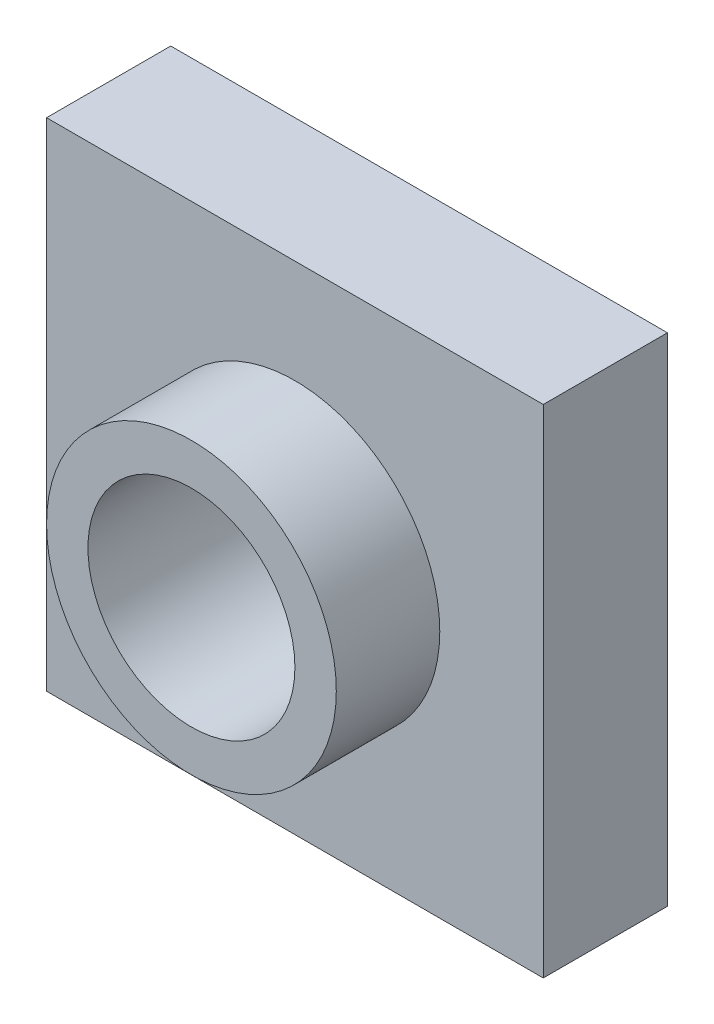
from build123d import *

# Parameters (mm, degrees)
SKETCH_1_W      = 120
SKETCH_1_H      = 120
SKETCH_1_R      = 25
EXTRUDE_1_DEPTH = 30
SKETCH_2_R      = 35
SKETCH_2_R_2    = 25
EXTRUDE_2_DEPTH = 25


with BuildPart() as part:
    # 草圖1 → 填料-伸長1 (new body)
    with BuildSketch(Plane.XY):
        with Locations((60, 60)):
            Rectangle(SKETCH_1_W, SKETCH_1_H)
        with Locations((60, 60)):
            Circle(SKETCH_1_R, mode=Mode.SUBTRACT)
    extrude(amount=EXTRUDE_1_DEPTH)

    # 草圖2 → 填料-伸長2 (add)
    with BuildSketch(Plane.XY.offset(30)):
        with Locations(Location((60, 60, 0), (0, 0, 180))):
            Circle(SKETCH_2_R)
        with Locations((60, 60)):
            Circle(SKETCH_2_R_2, mode=Mode.SUBTRACT)
    extrude(amount=EXTRUDE_2_DEPTH)


solid = part.part
